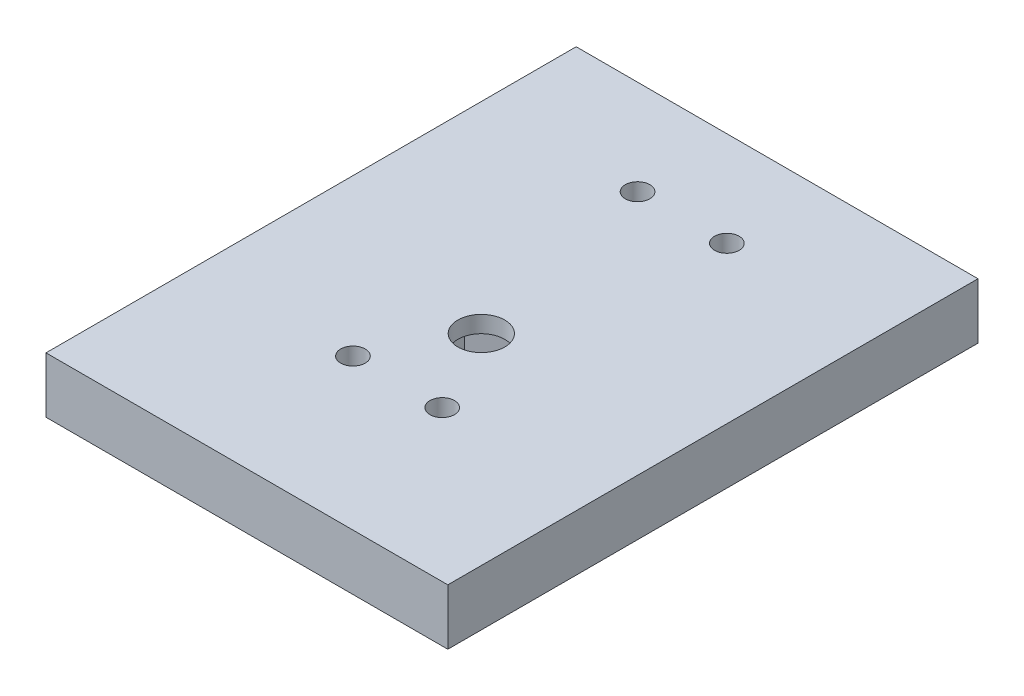
from build123d import *

# Parameters (mm, degrees)
SKETCH1_W           = 72
SKETCH1_H           = 95
SKETCH1_R           = 2.2
SKETCH1_R_2         = 2.194279912
BOSS_EXTRUDE1_DEPTH = 10
CUT_EXTRUDE1_DEPTH  = 7
CUT_EXTRUDE2_DEPTH  = 7


with BuildPart() as part:
    # Sketch1 → Boss-Extrude1 (new body)
    with BuildSketch(Plane(origin=(0, 0, 0), x_dir=(1, 0, 0), z_dir=(0, 1, 0))):
        with Locations((117.160731424, -19.82755102)):
            Rectangle(SKETCH1_W, SKETCH1_H)
        with Locations(Location((125.160731424, 10.67244898, 0), (0, 0, 270))):
            Circle(SKETCH1_R, mode=Mode.SUBTRACT)
        with Locations(Location((109.160731424, 10.67244898, 0), (0, 0, 270))):
            Circle(SKETCH1_R, mode=Mode.SUBTRACT)
        with Locations(Location((125.160731424, -40.32755102, 0), (0, 0, 270))):
            Circle(SKETCH1_R_2, mode=Mode.SUBTRACT)
        with Locations(Location((109.160731424, -40.32755102, 0), (0, 0, 270))):
            Circle(SKETCH1_R, mode=Mode.SUBTRACT)
    extrude(amount=BOSS_EXTRUDE1_DEPTH)

    # Sketch2 → Cut-Extrude1 (cut)
    with BuildSketch(Plane.XZ):
        Polygon((109.960731424, 21.170629082), (109.960731424, 29.484472959), (117.160731424, 33.641394897), (124.360731424, 29.484472959), (124.360731424, 21.170629082), (117.160731424, 17.013707144), align=None)
    extrude(amount=-CUT_EXTRUDE1_DEPTH, mode=Mode.SUBTRACT)

    # Sketch5 → Cut-Extrude2 (cut)
    with BuildSketch(Plane.XZ.offset(-7)):
        with BuildLine():
            ThreePointArc((121.360731424, 25.32755102), (120.130579905, 28.297399501), (117.160731424, 29.52755102))
            Line((117.160731424, 29.52755102), (117.160731424, 21.12755102))
            ThreePointArc((117.160731424, 21.12755102), (120.130579905, 22.357702539), (121.360731424, 25.32755102))
        make_face()
        with BuildLine():
            Line((117.160731424, 21.12755102), (117.160731424, 29.52755102))
            ThreePointArc((117.160731424, 29.52755102), (112.960731424, 25.32755102), (117.160731424, 21.12755102))
        make_face()
    extrude(amount=-CUT_EXTRUDE2_DEPTH, mode=Mode.SUBTRACT)


solid = part.part
